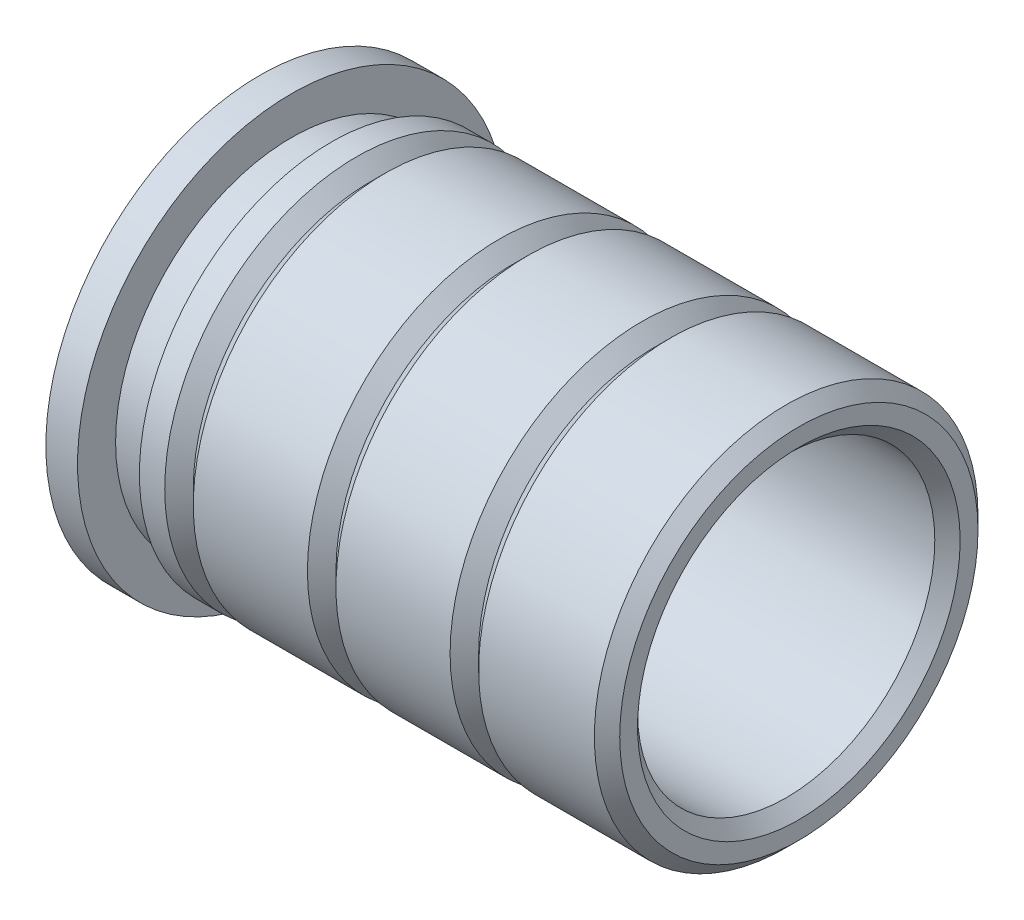
from build123d import *

# Parameters (mm, degrees)
CHAMFER1_SIZE   = 0.2032
CHAMFER2_SIZE   = 0.2032
LPATTERN1_COUNT = 3
LPATTERN1_PITCH = 2.286


with BuildPart() as part:
    # Sketch1 → Revolve1 (revolve)
    with BuildSketch(Plane.XY, mode=Mode.PRIVATE) as revolve1_sk:
        Polygon((0, 2.38125), (8.636, 2.38125), (8.636, 3.0734), (1.143, 3.0734), (1.143, 2.8194), (0.508, 2.8194), (0.508, 3.429), (0, 3.429), align=None)
    revolve(revolve1_sk.sketch.rotate(Axis((0, 0, 0), (-1, 0, 0)), 90), axis=Axis((0, 0, 0), (-1, 0, 0)))

    # Chamfer1
    chamfer1_edges = [part.edges().sort_by_distance(p)[0] for p in [
        (0, 0, 2.38125),
        (8.636, 0, 2.38125),
    ]]
    chamfer(chamfer1_edges, length=CHAMFER1_SIZE)

    # Chamfer2
    chamfer2_edges = [part.edges().sort_by_distance(p)[0] for p in [
        (8.636, 0, 3.0734),
    ]]
    chamfer(chamfer2_edges, length=CHAMFER2_SIZE)

    # Sketch2 → Cut-Revolve1 (revolve, cut)
    with BuildSketch(Plane.XY, mode=Mode.PRIVATE) as cut_revolve1_sk:
        Polygon((1.262276686, 3.360523314), (1.778, 2.8448), (2.293723314, 3.360523314), align=None)
    cut_revolve1 = revolve(cut_revolve1_sk.sketch.rotate(Axis((0, 0, 0), (-1, 0, 0)), 90), axis=Axis((0, 0, 0), (-1, 0, 0)), mode=Mode.SUBTRACT)

    # LPattern1: Cut-Revolve1 ×3
    with Locations(*[(i * LPATTERN1_PITCH, 0, 0) for i in range(1, LPATTERN1_COUNT)]):
        add(cut_revolve1, mode=Mode.SUBTRACT)


solid = part.part
